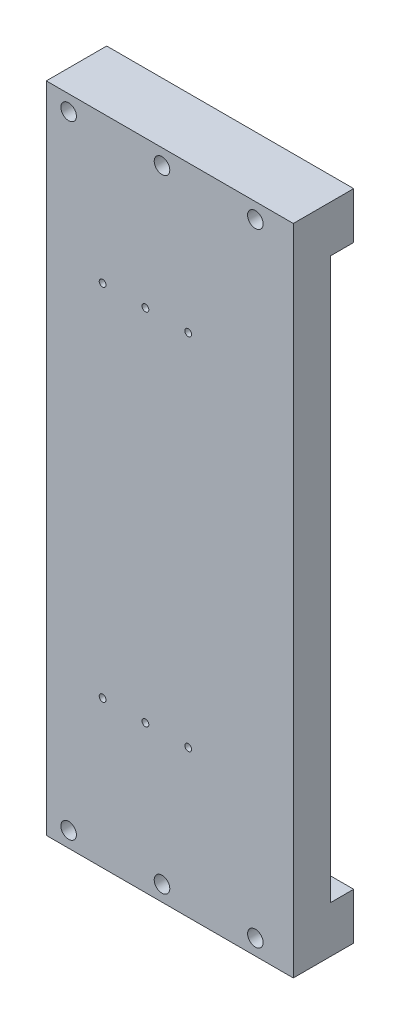
from build123d import *

# Parameters (mm, degrees)
SKETCH1_W           = 63.5
SKETCH1_H           = 168
BOSS_EXTRUDE1_DEPTH = 9.525
SKETCH4_W           = 63.5
SKETCH4_H           = 12
BOSS_EXTRUDE2_DEPTH = 6
SKETCH6_R           = 2
CUT_EXTRUDE1_DEPTH  = 181.270007558
SKETCH8_R           = 0.877320143
CUT_EXTRUDE4_DEPTH  = 180.852649758


with BuildPart() as part:
    # Sketch1 → Boss-Extrude1 (new body)
    with BuildSketch(Plane.XY):
        with Locations((31.75, 84)):
            Rectangle(SKETCH1_W, SKETCH1_H)
    extrude(amount=BOSS_EXTRUDE1_DEPTH)

    # Sketch4 → Boss-Extrude2 (add)
    with BuildSketch(Plane(origin=(0, 0, 0), x_dir=(-1, 0, 0), z_dir=(0, 0, -1))):
        with Locations((-31.75, 162)):
            Rectangle(SKETCH4_W, SKETCH4_H)
    boss_extrude2 = extrude(amount=BOSS_EXTRUDE2_DEPTH)

    # Sketch6 → Cut-Extrude1 (cut, through all)
    with BuildSketch(Plane(origin=(0, 0, -6), x_dir=(-1, 0, 0), z_dir=(0, 0, -1))):
        with Locations((-5.74011002, 164)):
            Circle(SKETCH6_R)
        with Locations((-53.74011002, 164)):
            Circle(SKETCH6_R)
        with Locations((-29.74011002, 164)):
            Circle(SKETCH6_R)
    cut_extrude1 = extrude(amount=-CUT_EXTRUDE1_DEPTH, mode=Mode.SUBTRACT)

    # Mirror1: Boss-Extrude2, Cut-Extrude1 across plane
    add(boss_extrude2.mirror(Plane.ZX.offset(84)))
    add(cut_extrude1.mirror(Plane.ZX.offset(84)), mode=Mode.SUBTRACT)

    # Sketch8 → Cut-Extrude4 (cut, symmetric)
    with BuildSketch(Plane(origin=(0, 0, 0), x_dir=(-1, 0, 0), z_dir=(0, 0, -1))):
        with Locations((-14.479670844, 130.185691353)):
            Circle(SKETCH8_R)
        with Locations((-25.479670844, 130.185691353)):
            Circle(SKETCH8_R)
        with Locations((-36.479670844, 130.185691353)):
            Circle(SKETCH8_R)
    cut_extrude4 = extrude(amount=CUT_EXTRUDE4_DEPTH, both=True, mode=Mode.SUBTRACT)

    # Mirror2: Cut-Extrude4 across plane
    add(cut_extrude4.mirror(Plane.ZX.offset(84)), mode=Mode.SUBTRACT)


solid = part.part
